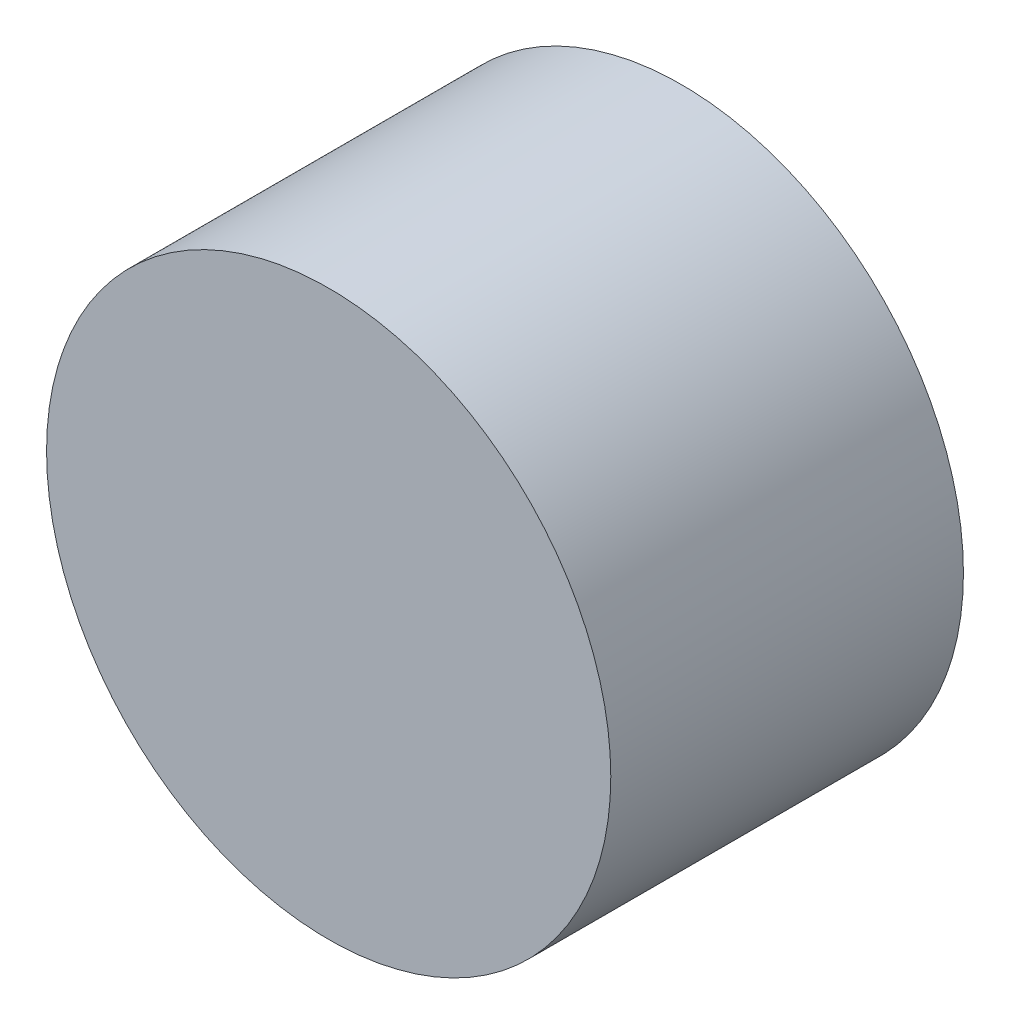
from build123d import *

# Parameters (mm, degrees)
SKETCH1_R           = 40
BOSS_EXTRUDE1_DEPTH = 50


with BuildPart() as part:
    # Sketch1 → Boss-Extrude1 (new body)
    with BuildSketch(Plane.XY):
        Circle(SKETCH1_R)
    extrude(amount=BOSS_EXTRUDE1_DEPTH)


solid = part.part
